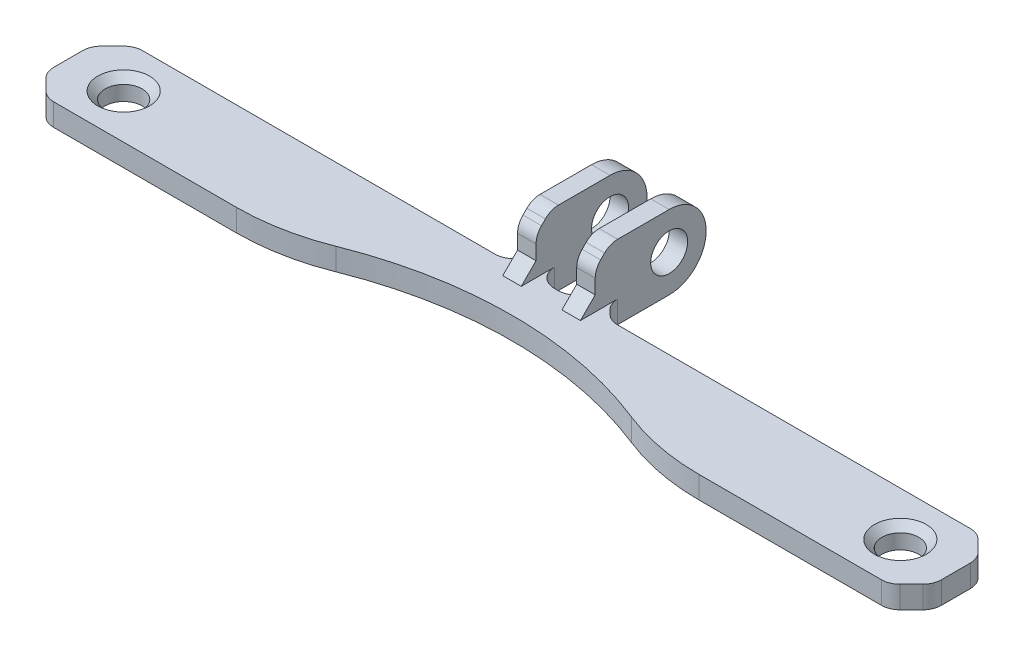
from build123d import *

# Parameters (mm, degrees)
SKETCH2_R                   = 2.5
BOSS_EXTRUDE1_DEPTH         = 3
BOSS_EXTRUDE2_START         = 2.75
SKETCH3_W                   = 15
SKETCH3_H                   = 10
BOSS_EXTRUDE2_DEPTH         = 2.5
FILLET2_RADIUS              = 5
FILLET2_LENGTH              = 2.5
FILLET2_OF_MIRROR1_2_RADIUS = 5
FILLET2_OF_MIRROR1_2_LENGTH = 2.5
CHAMFER1_SIZE               = 2
CHAMFER2_SIZE               = 2
SKETCH5_R                   = 2.5
CUT_EXTRUDE2_DEPTH          = 68.694626818
CHAMFER3_SIZE               = 3
FILLET3_R                   = 2.5
CHAMFER4_SIZE               = 1
FILLET4_R                   = 30.5


with BuildPart() as part:
    # Sketch2 → Boss-Extrude1 (new body)
    with BuildSketch(Plane(origin=(0, 0, 0), x_dir=(1, 0, 0), z_dir=(0, 1, 0))):
        with BuildLine():
            Line((60, 0), (-60, 0))
            Line((-60, 0), (-60, -12))
            Line((-60, -12), (-24.738633754, -12))
            ThreePointArc((-24.738633754, -12), (0, -6), (24.738633754, -12))
            Line((24.738633754, -12), (60, -12))
            Line((60, -12), (60, 0))
        make_face()
        with Locations(Location((-52.5, -6, 0), (0, 0, 270))):
            Circle(SKETCH2_R, mode=Mode.SUBTRACT)
        with Locations(Location((52.5, -6, 0), (0, 0, 270))):
            Circle(SKETCH2_R, mode=Mode.SUBTRACT)
    extrude(amount=BOSS_EXTRUDE1_DEPTH)

    # Sketch3 → Boss-Extrude2 (add)
    with BuildSketch(Plane(origin=(0, 0, 0), x_dir=(0, 0, -1), z_dir=(1, 0, 0)).offset(BOSS_EXTRUDE2_START)):
        with Locations((7.5, 5)):
            Rectangle(SKETCH3_W, SKETCH3_H)
    boss_extrude2 = extrude(amount=BOSS_EXTRUDE2_DEPTH)

    # Fillet2: full round fillet: the end face becomes a half cylinder, R = half its width
    fillet2_face = Plane((4, 5, -15), x_dir=(-1, 0, 0), z_dir=(0, 0, -1))  # on the end face: x along it, z out of the body
    fillet2_slab = fillet2_face.offset(-FILLET2_RADIUS / 2) * Box(FILLET2_LENGTH, 2 * FILLET2_RADIUS, FILLET2_RADIUS, mode=Mode.PRIVATE)  # the body's end, R deep
    fillet2_round = Plane((4, 5, -10), x_dir=(0, 0, -1), z_dir=(-1, 0, 0)) * Cylinder(FILLET2_RADIUS, FILLET2_LENGTH, mode=Mode.PRIVATE)  # its axis R under the face
    add(fillet2_slab - fillet2_round, mode=Mode.SUBTRACT)

    # Mirror1: Boss-Extrude2 across plane
    add(boss_extrude2.mirror(Plane(origin=(0, 0, 0), x_dir=(0, 0, 1), z_dir=(1, 0, 0))))

    # Fillet2 of Mirror1 2: full round fillet: the end face becomes a half cylinder, R = half its width
    fillet2_of_mirror1_2_face = Plane((-4, 5, -15), x_dir=(1, 0, 0), z_dir=(0, 0, -1))  # on the end face: x along it, z out of the body
    fillet2_of_mirror1_2_slab = fillet2_of_mirror1_2_face.offset(-FILLET2_OF_MIRROR1_2_RADIUS / 2) * Box(FILLET2_OF_MIRROR1_2_LENGTH, 2 * FILLET2_OF_MIRROR1_2_RADIUS, FILLET2_OF_MIRROR1_2_RADIUS, mode=Mode.PRIVATE)  # the body's end, R deep
    fillet2_of_mirror1_2_round = Plane((-4, 5, -10), x_dir=(0, 0, -1), z_dir=(1, 0, 0)) * Cylinder(FILLET2_OF_MIRROR1_2_RADIUS, FILLET2_OF_MIRROR1_2_LENGTH, mode=Mode.PRIVATE)  # its axis R under the face
    add(fillet2_of_mirror1_2_slab - fillet2_of_mirror1_2_round, mode=Mode.SUBTRACT)

    # Chamfer1
    chamfer1_edges = [part.edges().sort_by_distance(p)[0] for p in [
        (4, 3, 0),
        (-4, 3, 0),
    ]]
    chamfer(chamfer1_edges, length=CHAMFER1_SIZE)

    # Chamfer2
    chamfer2_edges = [part.edges().sort_by_distance(p)[0] for p in [
        (-5.25, 1.5, 0),
        (5.25, 1.5, 0),
        (4, 10, 0),
        (-4, 10, 0),
    ]]
    chamfer(chamfer2_edges, length=CHAMFER2_SIZE)

    # Sketch5 → Cut-Extrude2 (cut, through all)
    with BuildSketch(Plane(origin=(5.25, 0, 0), x_dir=(0, 0, -1), z_dir=(1, 0, 0))):
        with Locations((10, 5)):
            Circle(SKETCH5_R)
    extrude(amount=-CUT_EXTRUDE2_DEPTH, mode=Mode.SUBTRACT)

    # Chamfer3
    chamfer3_edges = [part.edges().sort_by_distance(p)[0] for p in [
        (-60, 1.5, 12),
        (-60, 1.5, 0),
        (60, 1.5, 0),
        (60, 1.5, 12),
    ]]
    chamfer(chamfer3_edges, length=CHAMFER3_SIZE)

    # Fillet3
    fillet3_edges = [part.edges().sort_by_distance(p)[0] for p in [
        (-57, 1.5, 0),
        (-7.25, 1.5, 0),
        (-5.25, 1.5, -2),
        (-2.75, 1.5, 0),
        (2.75, 1.5, 0),
        (5.25, 1.5, -2),
        (7.25, 1.5, 0),
        (57, 1.5, 0),
        (60, 1.5, 3),
        (60, 1.5, 9),
        (57, 1.5, 12),
        (-60, 1.5, 3),
        (4, 8, 0),
        (4, 10, -2),
        (-4, 10, -2),
        (-4, 8, 0),
        (-60, 1.5, 9),
        (-57, 1.5, 12),
    ]]
    fillet(fillet3_edges, radius=FILLET3_R)

    # Chamfer4
    chamfer4_edges = [part.edges().sort_by_distance(p)[0] for p in [
        (-52.5, 3, 3.5),
        (52.5, 3, 3.5),
    ]]
    chamfer(chamfer4_edges, length=CHAMFER4_SIZE)

    # Fillet4
    fillet4_edges = [part.edges().sort_by_distance(p)[0] for p in [
        (-24.738633754, 1.5, 12),
        (24.738633754, 1.5, 12),
    ]]
    fillet(fillet4_edges, radius=FILLET4_R)


solid = part.part
